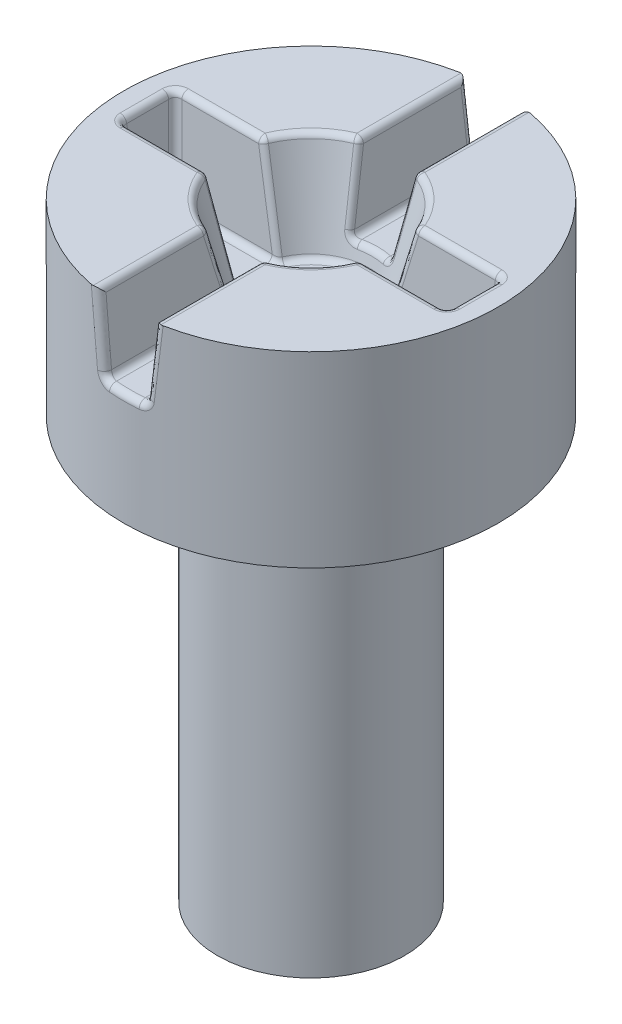
from build123d import *

# Parameters (mm, degrees)
SKETCH1_R           = 1
BOSS_EXTRUDE1_DEPTH = 4.5
SKETCH2_R           = 2
BOSS_EXTRUDE2_DEPTH = 2
SKETCH3_W           = 3.5
SKETCH3_H           = 0.6
CUT_EXTRUDE1_DEPTH  = 1
CUT_EXTRUDE1_DRAFT  = -5
SKETCH4_W           = 0.6
SKETCH4_H           = 5
CUT_EXTRUDE2_DEPTH  = 0.8
CUT_EXTRUDE2_DRAFT  = -6
SKETCH5_R           = 0.875
CUT_EXTRUDE3_DEPTH  = 1
CUT_EXTRUDE3_DRAFT  = -15
FILLET1_R           = 0.07


with BuildPart() as part:
    # Sketch1 → Boss-Extrude1 (new body)
    with BuildSketch(Plane(origin=(0, 0, 0), x_dir=(1, 0, 0), z_dir=(0, 1, 0))):
        with Locations(Location((0, 0, 0), (0, 0, 270))):
            Circle(SKETCH1_R)
    extrude(amount=-BOSS_EXTRUDE1_DEPTH)

    # Sketch2 → Boss-Extrude2 (add)
    with BuildSketch(Plane(origin=(0, 0, 0), x_dir=(1, 0, 0), z_dir=(0, 1, 0))):
        with Locations(Location((0, 0, 0), (0, 0, 270))):
            Circle(SKETCH2_R)
    extrude(amount=BOSS_EXTRUDE2_DEPTH)


with BuildPart() as cut_extrude1_tool:
    # Sketch3 → Cut-Extrude1 (with draft: the straight prism first)
    with BuildSketch(Plane(origin=(0, 2, 0), x_dir=(1, 0, 0), z_dir=(0, 1, 0))):
        Rectangle(SKETCH3_W, SKETCH3_H)
    extrude(amount=-CUT_EXTRUDE1_DEPTH)
    # Cut-Extrude1: the draft: its side faces are tilted about the plane it starts from
    cut_extrude1_sides = [cut_extrude1_tool.faces().sort_by_distance(p)[0] for p in [
        (-1.75, 1.5, 0),
        (0, 1.5, 0.3),
        (1.75, 1.5, 0),
        (0, 1.5, -0.3),
    ]]
    draft(cut_extrude1_sides, Plane(origin=(0, 2, 0), x_dir=(1, 0, 0), z_dir=(0, 1, 0)), CUT_EXTRUDE1_DRAFT)


with BuildPart() as part_1:
    add(part.part)

    # Cut-Extrude1: cut by cut_extrude1_tool
    add(cut_extrude1_tool.part, mode=Mode.SUBTRACT)


with BuildPart() as cut_extrude2_tool:
    # Sketch4 → Cut-Extrude2 (with draft: the straight prism first)
    with BuildSketch(Plane(origin=(0, 2, 0), x_dir=(1, 0, 0), z_dir=(0, 1, 0))):
        Rectangle(SKETCH4_W, SKETCH4_H)
    extrude(amount=-CUT_EXTRUDE2_DEPTH)
    # Cut-Extrude2: the draft: its side faces are tilted about the plane it starts from
    cut_extrude2_sides = [cut_extrude2_tool.faces().sort_by_distance(p)[0] for p in [
        (-0.3, 1.6, 0),
        (0, 1.6, 2.5),
        (0.3, 1.6, 0),
        (0, 1.6, -2.5),
    ]]
    draft(cut_extrude2_sides, Plane(origin=(0, 2, 0), x_dir=(1, 0, 0), z_dir=(0, 1, 0)), CUT_EXTRUDE2_DRAFT)


with BuildPart() as part_2:
    add(part_1.part)

    # Cut-Extrude2: cut by cut_extrude2_tool
    add(cut_extrude2_tool.part, mode=Mode.SUBTRACT)


with BuildPart() as cut_extrude3_tool:
    # Sketch5 → Cut-Extrude3 (with draft: the straight prism first)
    with BuildSketch(Plane(origin=(0, 2, 0), x_dir=(1, 0, 0), z_dir=(0, 1, 0))):
        Circle(SKETCH5_R)
    extrude(amount=-CUT_EXTRUDE3_DEPTH)
    # Cut-Extrude3: the draft: its side faces are tilted about the plane it starts from
    cut_extrude3_sides = [cut_extrude3_tool.faces().sort_by_distance(p)[0] for p in [
        (-0.875, 1.5, 0),
    ]]
    draft(cut_extrude3_sides, Plane(origin=(0, 2, 0), x_dir=(1, 0, 0), z_dir=(0, 1, 0)), CUT_EXTRUDE3_DRAFT)


with BuildPart() as part_3:
    add(part_2.part)

    # Cut-Extrude3: cut by cut_extrude3_tool
    add(cut_extrude3_tool.part, mode=Mode.SUBTRACT)

    # Fillet1
    fillet1_edges = [part_3.edges().sort_by_distance(p)[0] for p in [
        (1.662511336, 1, 0),
        (1.706255668, 1.5, -0.256255668),
        (-1.115574862, 1, 0.212511336),
        (1.706255668, 1.5, 0.256255668),
        (-1.706255668, 1.5, 0.256255668),
        (1.115574862, 1, -0.212511336),
        (-1.706255668, 1.5, -0.256255668),
        (1.75, 2, 0),
        (1.285982056, 2, -0.3),
        (-1.75, 2, 0),
        (-1.285982056, 2, 0.3),
        (0.25795895, 1.600006129, -1.983294527),
        (0.25795895, 1.600006129, 1.983294527),
        (0.215916612, 1.2, 1.306335691),
        (-0.25795895, 1.600006129, 1.983294527),
        (-0.25795895, 1.600006129, -1.983294527),
        (-0.215916612, 1.2, -1.306335691),
        (0.108116395, 1.2, 1.997075573),
        (0, 1.2, -2),
        (-0.3, 2, -1.399668052),
        (0.3, 2, 1.399668052),
        (-0.215916612, 1.2, 1.306335691),
        (0, 1.2, 0.660640646),
        (-0.3, 2, 1.399668052),
        (0.215916612, 1.2, -1.306335691),
        (0.3, 2, -1.399668052),
        (-1.115574862, 1, -0.212511336),
        (1.115574862, 1, 0.212511336),
        (-1.285982056, 2, -0.3),
        (1.285982056, 2, 0.3),
        (0, 1, 0.607050808),
        (0, 1, -0.607050808),
        (-0.618718434, 2, -0.618718434),
        (0.618718434, 2, -0.618718434),
        (0.618718434, 2, 0.618718434),
        (-0.618718434, 2, 0.618718434),
        (-0.695306559, 1.499998665, 0.256255551),
        (0.695306559, 1.499998665, 0.256255551),
        (0.257957606, 1.599993339, 0.723189589),
        (-0.257957606, 1.599993339, 0.723189589),
        (0.695306559, 1.499998665, -0.256255551),
        (-0.695306559, 1.499998665, -0.256255551),
        (-0.257957606, 1.599993339, -0.723189589),
        (0.257957606, 1.599993339, -0.723189589),
        (0, 1.2, -0.660640646),
    ]]
    fillet(fillet1_edges, radius=FILLET1_R)


solid = part_3.part
